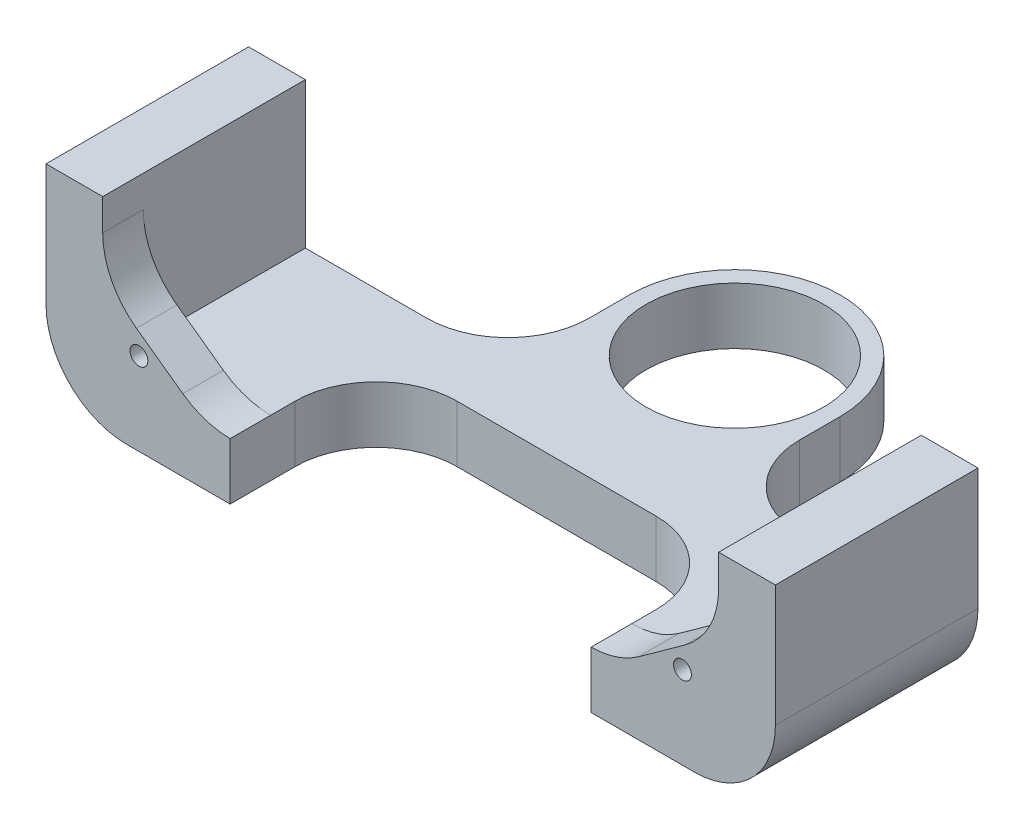
from build123d import *

# Parameters (mm, degrees)
SKETCH1_R           = 10.975
BOSS_EXTRUDE1_DEPTH = 7
SKETCH2_R           = 1.1
BOSS_EXTRUDE2_DEPTH = 5
BOSS_EXTRUDE3_DEPTH = 20
FILLET1_R           = 10
SKETCH5_W           = 44.549062666
SKETCH5_H           = 18
CUT_EXTRUDE2_DEPTH  = 7
FILLET2_R           = 10


with BuildPart() as part:
    # Sketch1 → Boss-Extrude1 (new body)
    with BuildSketch(Plane(origin=(0, 0, 0), x_dir=(1, 0, 0), z_dir=(0, 1, 0))):
        with BuildLine():
            Line((0, 0), (0, -40))
            Line((0, -40), (26, -40))
            Line((26, -40), (26, 0))
            ThreePointArc((26, 0), (13, 13), (0, 0))
        make_face()
        with Locations(Location((13, 0, 0), (0, 0, 270))):
            Circle(SKETCH1_R, mode=Mode.SUBTRACT)
    extrude(amount=BOSS_EXTRUDE1_DEPTH)

    # Sketch2 → Boss-Extrude2 (add)
    with BuildSketch(Plane.XY.offset(40)):
        Polygon((51, 16), (51, 25), (58, 25), (58, 0), (26, 0), (26, 7), (38.5, 7), align=None)
        with Locations((46.535375551, 10.214529603)):
            Circle(SKETCH2_R, mode=Mode.SUBTRACT)
    boss_extrude2 = extrude(amount=-BOSS_EXTRUDE2_DEPTH)

    # Sketch3 → Boss-Extrude3 (add)
    with BuildSketch(Plane(origin=(0, 0, 35), x_dir=(-1, 0, 0), z_dir=(0, 0, -1))):
        Polygon((-51, 16), (-51, 7), (-38.5, 7), (-26, 7), (-26, 0), (-58, 0), (-58, 25), (-51, 25), align=None)
    boss_extrude3 = extrude(amount=BOSS_EXTRUDE3_DEPTH)

    # Mirror1: Boss-Extrude2, Boss-Extrude3 across plane
    add(boss_extrude2.mirror(Plane(origin=(13, 0, 0), x_dir=(0, 0, 1), z_dir=(1, 0, 0))))
    add(boss_extrude3.mirror(Plane(origin=(13, 0, 0), x_dir=(0, 0, 1), z_dir=(1, 0, 0))))

    # Fillet1
    fillet1_edges = [part.edges().sort_by_distance(p)[0] for p in [
        (51, 16, 37.5),
        (58, 0, 27.5),
        (38.5, 7, 37.5),
        (26, 3.5, 15),
        (-25, 16, 37.5),
        (-12.5, 7, 37.5),
        (-32, 0, 27.5),
        (0, 3.5, 15),
    ]]
    fillet(fillet1_edges, radius=FILLET1_R)

    # Sketch5 → Cut-Extrude2 (cut)
    with BuildSketch(Plane(origin=(0, 7, 0), x_dir=(1, 0, 0), z_dir=(0, 1, 0))):
        with Locations((13, -31)):
            Rectangle(SKETCH5_W, SKETCH5_H)
    extrude(amount=-CUT_EXTRUDE2_DEPTH, mode=Mode.SUBTRACT)

    # Fillet2
    fillet2_edges = [part.edges().sort_by_distance(p)[0] for p in [
        (-9.274531333, 3.5, 22),
        (35.274531333, 3.5, 22),
    ]]
    fillet(fillet2_edges, radius=FILLET2_R)


solid = part.part
